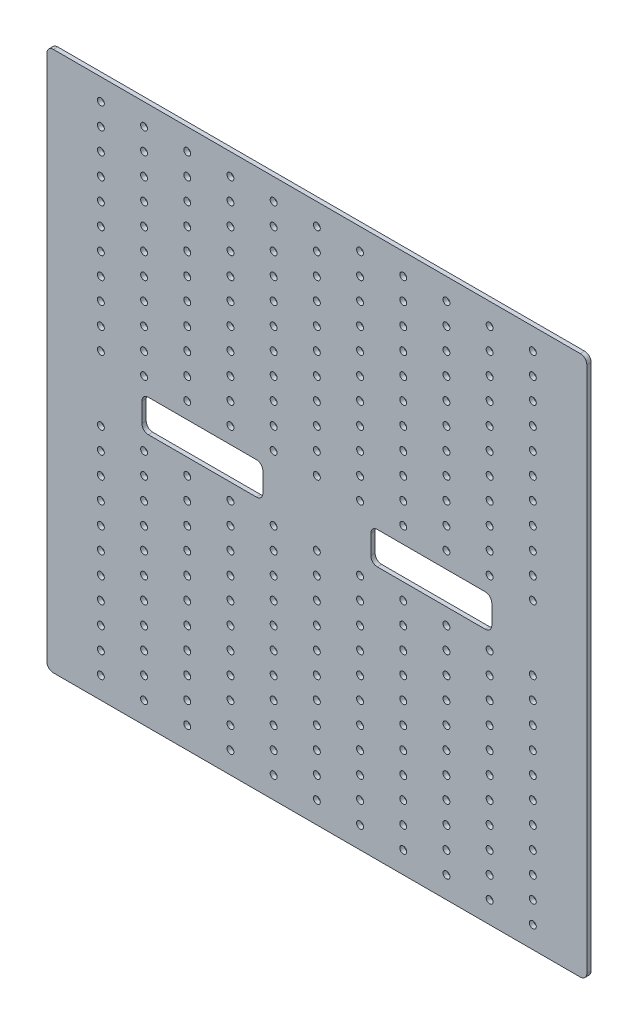
from build123d import *

# Parameters (mm, degrees)
SKETCH1_W           = 250
SKETCH1_H           = 250
BOSS_EXTRUDE1_DEPTH = 2
FILLET1_R           = 3
SKETCH2_R           = 1.6
CUT_EXTRUDE1_DEPTH  = 2
CUT_EXTRUDE2_DEPTH  = 2


with BuildPart() as part:
    # Sketch1 → Boss-Extrude1 (new body)
    with BuildSketch(Plane.XY):
        with Locations((125, 125)):
            Rectangle(SKETCH1_W, SKETCH1_H)
    extrude(amount=BOSS_EXTRUDE1_DEPTH)

    # Fillet1
    fillet1_edges = [part.edges().sort_by_distance(p)[0] for p in [
        (0, 0, 1),
        (250, 0, 1),
        (0, 250, 1),
        (250, 250, 1),
    ]]
    fillet(fillet1_edges, radius=FILLET1_R)

    # Sketch2 → Cut-Extrude1 (cut)
    with BuildSketch(Plane.XY.offset(2)):
        with Locations((25, 240)):
            Circle(SKETCH2_R)
        with Locations((45, 240)):
            Circle(SKETCH2_R)
        with Locations((65, 240)):
            Circle(SKETCH2_R)
        with Locations((85, 240)):
            Circle(SKETCH2_R)
        with Locations((105, 240)):
            Circle(SKETCH2_R)
        with Locations((125, 240)):
            Circle(SKETCH2_R)
        with Locations((145, 240)):
            Circle(SKETCH2_R)
        with Locations((165, 240)):
            Circle(SKETCH2_R)
        with Locations((185, 240)):
            Circle(SKETCH2_R)
        with Locations((205, 240)):
            Circle(SKETCH2_R)
        with Locations((225, 240)):
            Circle(SKETCH2_R)
        with Locations((45, 230)):
            Circle(SKETCH2_R)
        with Locations((65, 230)):
            Circle(SKETCH2_R)
        with Locations((85, 230)):
            Circle(SKETCH2_R)
        with Locations((105, 230)):
            Circle(SKETCH2_R)
        with Locations((125, 230)):
            Circle(SKETCH2_R)
        with Locations((145, 230)):
            Circle(SKETCH2_R)
        with Locations((165, 230)):
            Circle(SKETCH2_R)
        with Locations((185, 230)):
            Circle(SKETCH2_R)
        with Locations((205, 230)):
            Circle(SKETCH2_R)
        with Locations((225, 230)):
            Circle(SKETCH2_R)
        with Locations((45, 220)):
            Circle(SKETCH2_R)
        with Locations((65, 220)):
            Circle(SKETCH2_R)
        with Locations((85, 220)):
            Circle(SKETCH2_R)
        with Locations((105, 220)):
            Circle(SKETCH2_R)
        with Locations((125, 220)):
            Circle(SKETCH2_R)
        with Locations((145, 220)):
            Circle(SKETCH2_R)
        with Locations((165, 220)):
            Circle(SKETCH2_R)
        with Locations((185, 220)):
            Circle(SKETCH2_R)
        with Locations((205, 220)):
            Circle(SKETCH2_R)
        with Locations((225, 220)):
            Circle(SKETCH2_R)
        with Locations((45, 210)):
            Circle(SKETCH2_R)
        with Locations((65, 210)):
            Circle(SKETCH2_R)
        with Locations((85, 210)):
            Circle(SKETCH2_R)
        with Locations((105, 210)):
            Circle(SKETCH2_R)
        with Locations((125, 210)):
            Circle(SKETCH2_R)
        with Locations((145, 210)):
            Circle(SKETCH2_R)
        with Locations((165, 210)):
            Circle(SKETCH2_R)
        with Locations((185, 210)):
            Circle(SKETCH2_R)
        with Locations((205, 210)):
            Circle(SKETCH2_R)
        with Locations((225, 210)):
            Circle(SKETCH2_R)
        with Locations((45, 200)):
            Circle(SKETCH2_R)
        with Locations((65, 200)):
            Circle(SKETCH2_R)
        with Locations((85, 200)):
            Circle(SKETCH2_R)
        with Locations((105, 200)):
            Circle(SKETCH2_R)
        with Locations((125, 200)):
            Circle(SKETCH2_R)
        with Locations((145, 200)):
            Circle(SKETCH2_R)
        with Locations((165, 200)):
            Circle(SKETCH2_R)
        with Locations((185, 200)):
            Circle(SKETCH2_R)
        with Locations((205, 200)):
            Circle(SKETCH2_R)
        with Locations((225, 200)):
            Circle(SKETCH2_R)
        with Locations((45, 190)):
            Circle(SKETCH2_R)
        with Locations((65, 190)):
            Circle(SKETCH2_R)
        with Locations((85, 190)):
            Circle(SKETCH2_R)
        with Locations((105, 190)):
            Circle(SKETCH2_R)
        with Locations((125, 190)):
            Circle(SKETCH2_R)
        with Locations((145, 190)):
            Circle(SKETCH2_R)
        with Locations((165, 190)):
            Circle(SKETCH2_R)
        with Locations((185, 190)):
            Circle(SKETCH2_R)
        with Locations((205, 190)):
            Circle(SKETCH2_R)
        with Locations((225, 190)):
            Circle(SKETCH2_R)
        with Locations((45, 180)):
            Circle(SKETCH2_R)
        with Locations((65, 180)):
            Circle(SKETCH2_R)
        with Locations((85, 180)):
            Circle(SKETCH2_R)
        with Locations((105, 180)):
            Circle(SKETCH2_R)
        with Locations((125, 180)):
            Circle(SKETCH2_R)
        with Locations((145, 180)):
            Circle(SKETCH2_R)
        with Locations((165, 180)):
            Circle(SKETCH2_R)
        with Locations((185, 180)):
            Circle(SKETCH2_R)
        with Locations((205, 180)):
            Circle(SKETCH2_R)
        with Locations((225, 180)):
            Circle(SKETCH2_R)
        with Locations((45, 170)):
            Circle(SKETCH2_R)
        with Locations((65, 170)):
            Circle(SKETCH2_R)
        with Locations((85, 170)):
            Circle(SKETCH2_R)
        with Locations((105, 170)):
            Circle(SKETCH2_R)
        with Locations((125, 170)):
            Circle(SKETCH2_R)
        with Locations((145, 170)):
            Circle(SKETCH2_R)
        with Locations((165, 170)):
            Circle(SKETCH2_R)
        with Locations((185, 170)):
            Circle(SKETCH2_R)
        with Locations((205, 170)):
            Circle(SKETCH2_R)
        with Locations((225, 170)):
            Circle(SKETCH2_R)
        with Locations((45, 160)):
            Circle(SKETCH2_R)
        with Locations((65, 160)):
            Circle(SKETCH2_R)
        with Locations((85, 160)):
            Circle(SKETCH2_R)
        with Locations((105, 160)):
            Circle(SKETCH2_R)
        with Locations((125, 160)):
            Circle(SKETCH2_R)
        with Locations((145, 160)):
            Circle(SKETCH2_R)
        with Locations((165, 160)):
            Circle(SKETCH2_R)
        with Locations((185, 160)):
            Circle(SKETCH2_R)
        with Locations((205, 160)):
            Circle(SKETCH2_R)
        with Locations((225, 160)):
            Circle(SKETCH2_R)
        with Locations((45, 150)):
            Circle(SKETCH2_R)
        with Locations((65, 150)):
            Circle(SKETCH2_R)
        with Locations((85, 150)):
            Circle(SKETCH2_R)
        with Locations((105, 150)):
            Circle(SKETCH2_R)
        with Locations((125, 150)):
            Circle(SKETCH2_R)
        with Locations((145, 150)):
            Circle(SKETCH2_R)
        with Locations((165, 150)):
            Circle(SKETCH2_R)
        with Locations((185, 150)):
            Circle(SKETCH2_R)
        with Locations((205, 150)):
            Circle(SKETCH2_R)
        with Locations((225, 150)):
            Circle(SKETCH2_R)
        with Locations((45, 140)):
            Circle(SKETCH2_R)
        with Locations((65, 140)):
            Circle(SKETCH2_R)
        with Locations((85, 140)):
            Circle(SKETCH2_R)
        with Locations((105, 140)):
            Circle(SKETCH2_R)
        with Locations((125, 140)):
            Circle(SKETCH2_R)
        with Locations((145, 140)):
            Circle(SKETCH2_R)
        with Locations((165, 140)):
            Circle(SKETCH2_R)
        with Locations((185, 140)):
            Circle(SKETCH2_R)
        with Locations((205, 140)):
            Circle(SKETCH2_R)
        with Locations((225, 140)):
            Circle(SKETCH2_R)
        with Locations((25, 230)):
            Circle(SKETCH2_R)
        with Locations((25, 220)):
            Circle(SKETCH2_R)
        with Locations((25, 210)):
            Circle(SKETCH2_R)
        with Locations((25, 200)):
            Circle(SKETCH2_R)
        with Locations((25, 190)):
            Circle(SKETCH2_R)
        with Locations((25, 180)):
            Circle(SKETCH2_R)
        with Locations((25, 170)):
            Circle(SKETCH2_R)
        with Locations((25, 160)):
            Circle(SKETCH2_R)
        with Locations((25, 150)):
            Circle(SKETCH2_R)
        with Locations((25, 140)):
            Circle(SKETCH2_R)
    cut_extrude1 = extrude(amount=-CUT_EXTRUDE1_DEPTH, mode=Mode.SUBTRACT)

    # Mirror1: Cut-Extrude1 across plane
    add(cut_extrude1.mirror(Plane(origin=(0, 125, 0), x_dir=(0, 0, 1), z_dir=(0, -1, 0))), mode=Mode.SUBTRACT)

    # Sketch5 → Cut-Extrude2 (cut)
    with BuildSketch(Plane.XY.offset(2)):
        with BuildLine():
            Line((150, 120.5), (150, 129.5))
            ThreePointArc((150, 129.5), (150.878679656, 131.621320344), (153, 132.5))
            Line((153, 132.5), (203, 132.5))
            ThreePointArc((203, 132.5), (205.121320344, 131.621320344), (206, 129.5))
            Line((206, 129.5), (206, 120.5))
            ThreePointArc((206, 120.5), (205.121320344, 118.378679656), (203, 117.5))
            Line((203, 117.5), (153, 117.5))
            ThreePointArc((153, 117.5), (150.878679656, 118.378679656), (150, 120.5))
        make_face()
        with BuildLine():
            Line((44, 129.5), (44, 120.5))
            ThreePointArc((44, 120.5), (44.878679656, 118.378679656), (47, 117.5))
            Line((47, 117.5), (97, 117.5))
            ThreePointArc((97, 117.5), (99.121320344, 118.378679656), (100, 120.5))
            Line((100, 120.5), (100, 129.5))
            ThreePointArc((100, 129.5), (99.121320344, 131.621320344), (97, 132.5))
            Line((97, 132.5), (47, 132.5))
            ThreePointArc((47, 132.5), (44.878679656, 131.621320344), (44, 129.5))
        make_face()
    extrude(amount=-CUT_EXTRUDE2_DEPTH, mode=Mode.SUBTRACT)


solid = part.part
